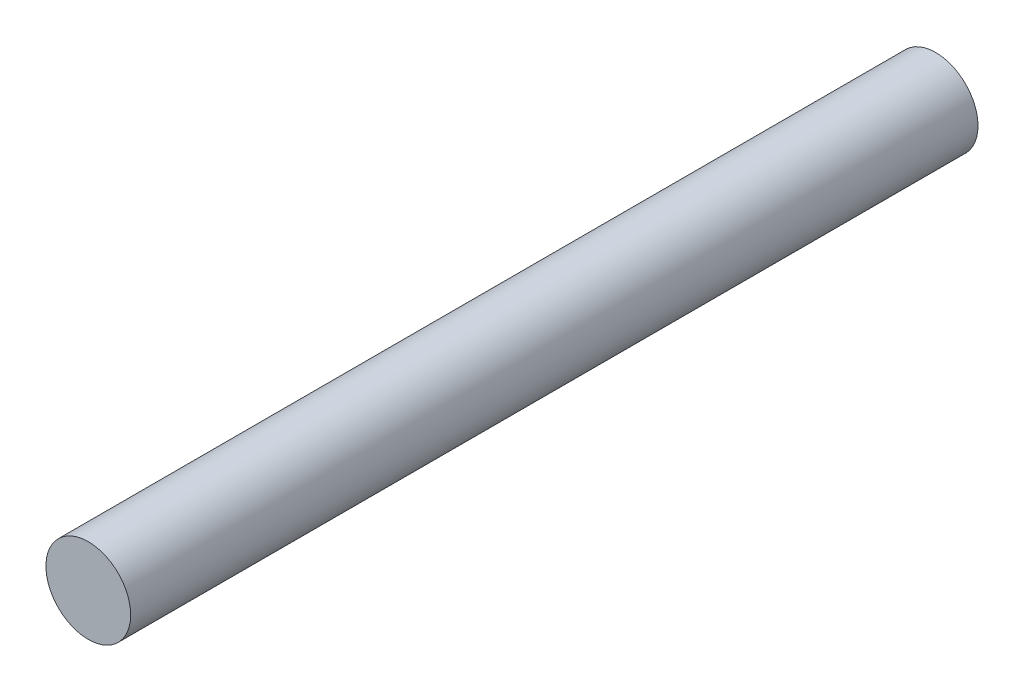
from build123d import *

# Parameters (mm, degrees)
SKETCH1_R           = 500
BOSS_EXTRUDE1_DEPTH = 10000


with BuildPart() as part:
    # Sketch1 → Boss-Extrude1 (new body)
    with BuildSketch(Plane.XY):
        Circle(SKETCH1_R)
    extrude(amount=BOSS_EXTRUDE1_DEPTH)


solid = part.part
